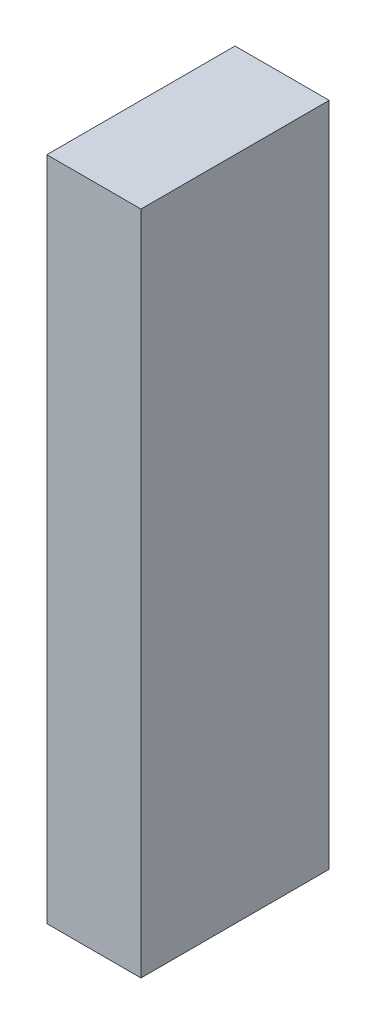
from build123d import *

# Parameters (mm, degrees)
SKETCH1_W           = 50.8
SKETCH1_H           = 101.6
BOSS_EXTRUDE1_DEPTH = 359.41


with BuildPart() as part:
    # Sketch1 → Boss-Extrude1 (new body)
    with BuildSketch(Plane(origin=(0, 0, 0), x_dir=(1, 0, 0), z_dir=(0, 1, 0))):
        Rectangle(SKETCH1_W, SKETCH1_H)
    extrude(amount=BOSS_EXTRUDE1_DEPTH)


solid = part.part
